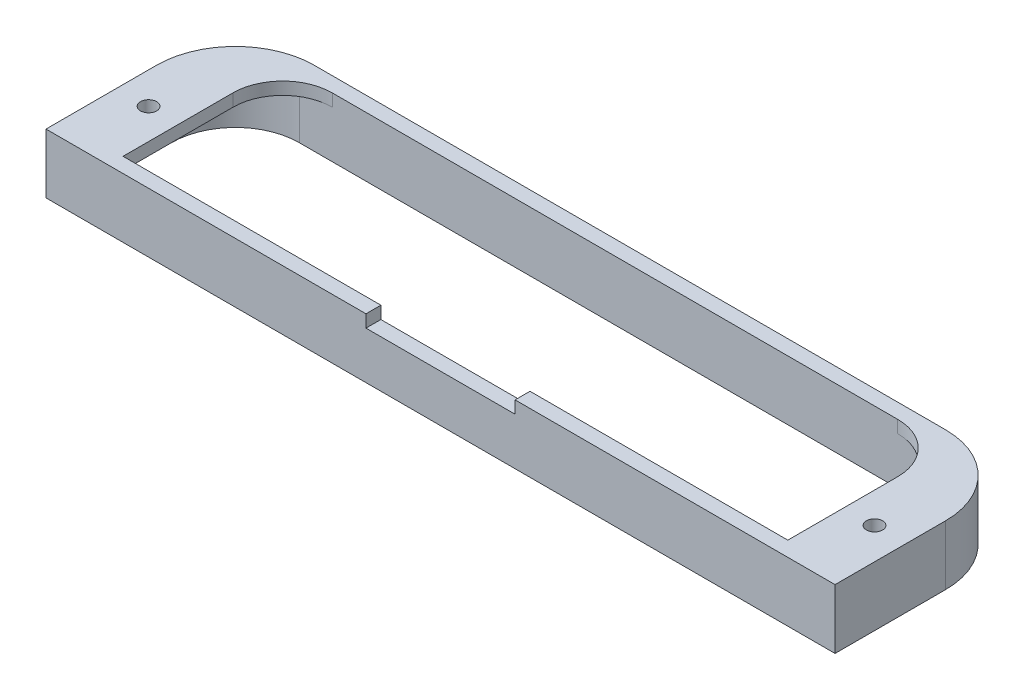
from build123d import *

# Parameters (mm, degrees)
BOSS_EXTRUDE1_DEPTH  = 2
M2_CLEARANCE_HOLE1_D = 2.6
BOSS_EXTRUDE2_START  = 7.6
BOSS_EXTRUDE2_DEPTH  = 7.6
SKETCH9_W            = 24
SKETCH9_H            = 2.4
CUT_EXTRUDE1_DEPTH   = 2


with BuildPart() as part:
    # Sketch1 → Boss-Extrude1 (new body)
    with BuildSketch(Plane(origin=(0, 0, 0), x_dir=(1, 0, 0), z_dir=(0, 1, 0))):
        with BuildLine():
            Line((-63.5, 0), (-53.5, 0))
            Line((-53.5, 0), (53.5, 0))
            Line((53.5, 0), (63.5, 0))
            Line((63.5, 0), (63.5, 17.78))
            ThreePointArc((63.5, 17.78), (59.780256121, 26.760256121), (50.8, 30.48))
            Line((50.8, 30.48), (-50.8, 30.48))
            ThreePointArc((-50.8, 30.48), (-59.780256121, 26.760256121), (-63.5, 17.78))
            Line((-63.5, 17.78), (-63.5, 0))
        make_face()
        with BuildLine():
            Line((-53.5, 2.4), (-53.5, 20.08))
            ThreePointArc((-53.5, 20.08), (-51.156854249, 25.736854249), (-45.5, 28.08))
            Line((-45.5, 28.08), (45.5, 28.08))
            ThreePointArc((45.5, 28.08), (51.156854249, 25.736854249), (53.5, 20.08))
            Line((53.5, 20.08), (53.5, 2.4))
            Line((53.5, 2.4), (-53.5, 2.4))
        make_face(mode=Mode.SUBTRACT)
    extrude(amount=BOSS_EXTRUDE1_DEPTH)

    # M2 Clearance Hole1 (through all)
    with Locations(Plane(origin=(0, 2, 0), x_dir=(1, 0, 0), z_dir=(0, 1, 0))):
        with Locations((-58.42, 11.43), (58.42, 11.43)):
            Hole(M2_CLEARANCE_HOLE1_D / 2)

    # Sketch8 → Boss-Extrude2 (add)
    with BuildSketch(Plane(origin=(0, 0, 0), x_dir=(-1, 0, 0), z_dir=(0, -1, 0)).offset(BOSS_EXTRUDE2_START)):
        with BuildLine():
            Line((63.5, 0), (63.5, 17.78))
            ThreePointArc((63.5, 17.78), (59.780256121, 26.760256121), (50.8, 30.48))
            Line((50.8, 30.48), (-50.8, 30.48))
            ThreePointArc((-50.8, 30.48), (-59.780256121, 26.760256121), (-63.5, 17.78))
            Line((-63.5, 17.78), (-63.5, 0))
            Line((-63.5, 0), (63.5, 0))
        make_face()
        with BuildLine():
            Line((-61.1, 2.4), (61.1, 2.4))
            Line((61.1, 2.4), (61.1, 17.78))
            ThreePointArc((61.1, 17.78), (58.083199846, 25.063199846), (50.8, 28.08))
            Line((50.8, 28.08), (-50.8, 28.08))
            ThreePointArc((-50.8, 28.08), (-58.083199846, 25.063199846), (-61.1, 17.78))
            Line((-61.1, 17.78), (-61.1, 2.4))
        make_face(mode=Mode.SUBTRACT)
    extrude(amount=-BOSS_EXTRUDE2_DEPTH)

    # Sketch9 → Cut-Extrude1 (cut)
    with BuildSketch(Plane(origin=(0, 2, 0), x_dir=(1, 0, 0), z_dir=(0, 1, 0))):
        with Locations((0, 1.2)):
            Rectangle(SKETCH9_W, SKETCH9_H)
    extrude(amount=-CUT_EXTRUDE1_DEPTH, mode=Mode.SUBTRACT)


solid = part.part
